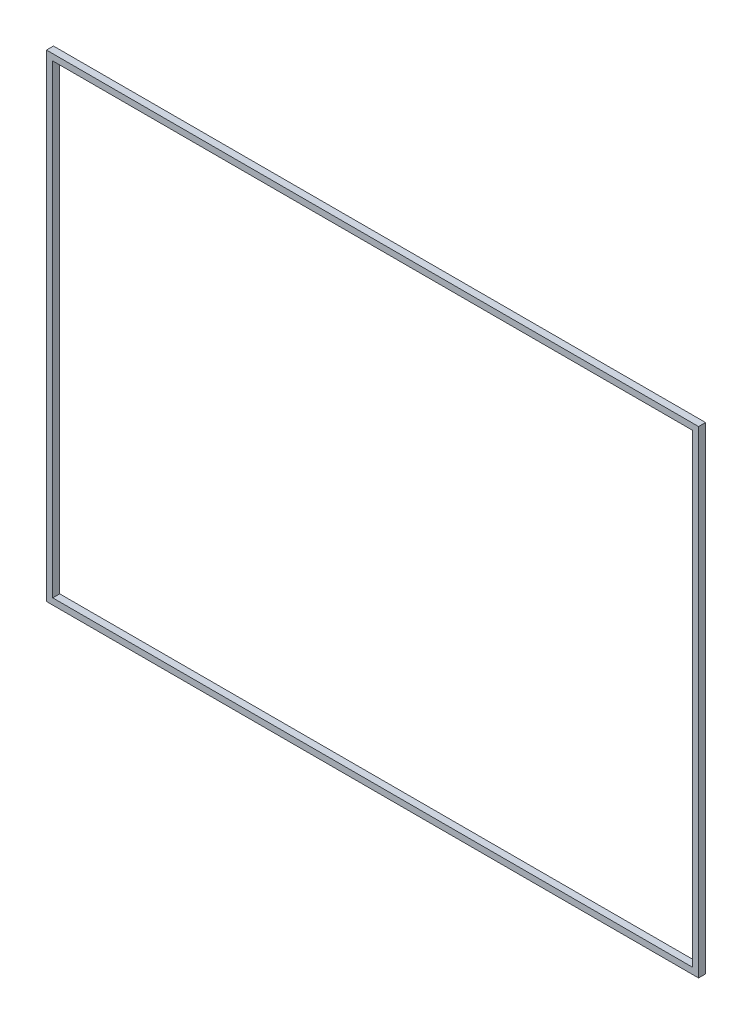
from build123d import *

# Parameters (mm, degrees)
GASKET_START = 42.5
SKETCH1_W    = 186.8
SKETCH1_H    = 136.8
SKETCH1_W_2  = 183.2
SKETCH1_H_2  = 133.2
GASKET_DEPTH = 2


with BuildPart() as part:
    # Sketch1 → Gasket (new body)
    with BuildSketch(Plane.XY.offset(GASKET_START)):
        Rectangle(SKETCH1_W, SKETCH1_H)
        Rectangle(SKETCH1_W_2, SKETCH1_H_2, mode=Mode.SUBTRACT)
    extrude(amount=GASKET_DEPTH)


solid = part.part
